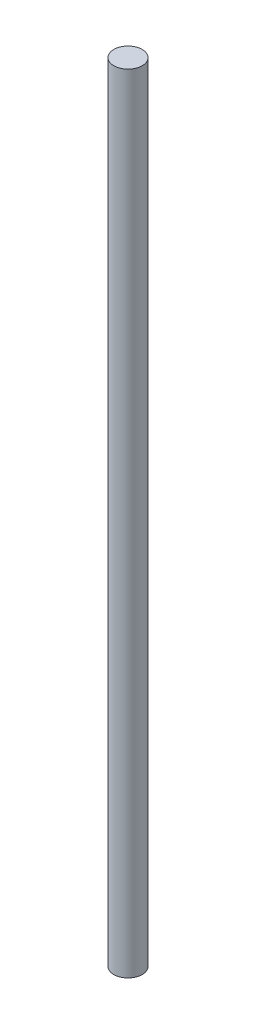
from build123d import *

# Parameters (mm, degrees)
SKETCH1_R           = 2
BOSS_EXTRUDE1_DEPTH = 111


with BuildPart() as part:
    # Sketch1 → Boss-Extrude1 (new body)
    with BuildSketch(Plane(origin=(0, 0, 0), x_dir=(1, 0, 0), z_dir=(0, 1, 0))):
        with Locations(Location((0, 0, 0), (0, 0, 270))):
            Circle(SKETCH1_R)
    extrude(amount=BOSS_EXTRUDE1_DEPTH)


solid = part.part
